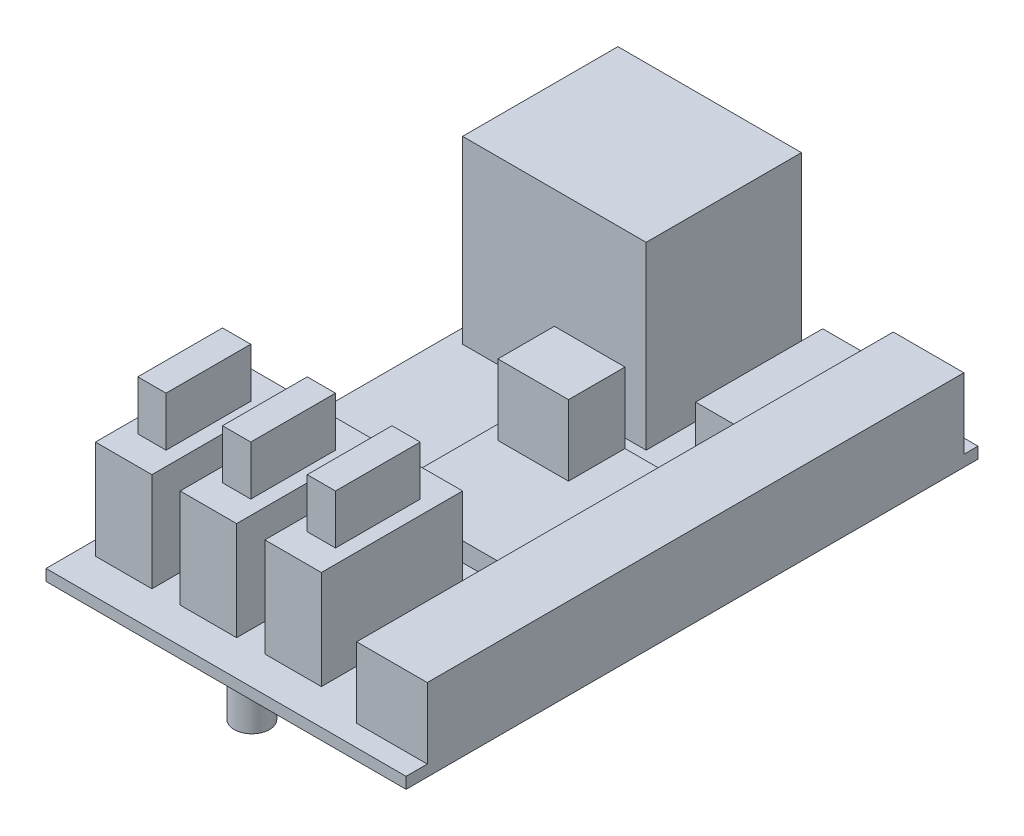
from build123d import *

# Parameters (mm, degrees)
SK_P01_STANDOFF_R                  = 2.5
P01_STANDOFF_DEPTH                 = 6
SK_P02_STANDOFF_R                  = 2.5
P02_STANDOFF_DEPTH                 = 6
P03_PERMAPROTOHALFSIZEBOARD_START  = 6
SK_P03_PERMAPROTOHALFSIZEBOARD_W   = 51
SK_P03_PERMAPROTOHALFSIZEBOARD_H   = 81
P03_PERMAPROTOHALFSIZEBOARD_DEPTH  = 1.6
P04_K1RELAYCB1AFP12V_START         = 7.6
SK_P04_K1RELAYCB1AFP12V_W          = 26
SK_P04_K1RELAYCB1AFP12V_H          = 22
P04_K1RELAYCB1AFP12V_DEPTH         = 25.5
P05_R1D3D4K1COIL_START             = 7.6
SK_P05_R1D3D4K1COIL_W              = 8
SK_P05_R1D3D4K1COIL_H              = 18
P05_R1D3D4K1COIL_DEPTH             = 5.4
P06_INA2601MOTOR_START             = 7.6
SK_P06_INA2601MOTOR_W              = 22.9
SK_P06_INA2601MOTOR_H              = 22.8
P06_INA2601MOTOR_DEPTH             = 2.7
P07_INA260TERMINALBLOCK_START      = 10.3
SK_P07_INA260TERMINALBLOCK_W       = 10
SK_P07_INA260TERMINALBLOCK_H       = 8
P07_INA260TERMINALBLOCK_DEPTH      = 10
P08_F1HOLDER30APCBBLADE_START      = 7.6
SK_P08_F1HOLDER30APCBBLADE_W       = 8
SK_P08_F1HOLDER30APCBBLADE_H       = 20
P08_F1HOLDER30APCBBLADE_DEPTH      = 14
P09_F115AFUSE_START                = 21.6
SK_P09_F115AFUSE_W                 = 4
SK_P09_F115AFUSE_H                 = 12
P09_F115AFUSE_DEPTH                = 7
P10_F3HOLDER_START                 = 7.6
SK_P10_F3HOLDER_W                  = 8
SK_P10_F3HOLDER_H                  = 20
P10_F3HOLDER_DEPTH                 = 14
P11_F33AFUSE_START                 = 21.6
SK_P11_F33AFUSE_W                  = 4
SK_P11_F33AFUSE_H                  = 12
P11_F33AFUSE_DEPTH                 = 7
P12_F4HOLDER_START                 = 7.6
SK_P12_F4HOLDER_W                  = 8
SK_P12_F4HOLDER_H                  = 20
P12_F4HOLDER_DEPTH                 = 14
P13_F43AFUSE_START                 = 21.6
SK_P13_F43AFUSE_W                  = 4
SK_P13_F43AFUSE_H                  = 12
P13_F43AFUSE_DEPTH                 = 7
P14_TERMINALBLOCKSTB1TB4WIRE_START = 7.6
SK_P14_TERMINALBLOCKSTB1TB4WIRE_W  = 10
SK_P14_TERMINALBLOCKSTB1TB4WIRE_H  = 76
P14_TERMINALBLOCKSTB1TB4WIRE_DEPTH = 10


with BuildPart() as part:
    # SK_P01_Standoff → P01_Standoff (new body)
    with BuildSketch(Plane(origin=(0, 0, 0), x_dir=(1, 0, 0), z_dir=(0, 1, 0))):
        with Locations(Location((0, 36.85, 0), (0, 0, 270))):
            Circle(SK_P01_STANDOFF_R)
    extrude(amount=P01_STANDOFF_DEPTH)



with BuildPart() as body_2:
    # SK_P02_Standoff → P02_Standoff (new body)
    with BuildSketch(Plane(origin=(0, 0, 0), x_dir=(1, 0, 0), z_dir=(0, 1, 0))):
        with Locations(Location((0, -36.85, 0), (0, 0, 270))):
            Circle(SK_P02_STANDOFF_R)
    extrude(amount=P02_STANDOFF_DEPTH)


with BuildPart() as part_1:
    add(part.part)

    add(body_2.part)  # P03_PermaProtohalfsizeboard merges body 2
    # SK_P03_PermaProtohalfsizeboard → P03_PermaProtohalfsizeboard (add)
    with BuildSketch(Plane(origin=(0, 0, 0), x_dir=(1, 0, 0), z_dir=(0, 1, 0)).offset(P03_PERMAPROTOHALFSIZEBOARD_START)):
        Rectangle(SK_P03_PERMAPROTOHALFSIZEBOARD_W, SK_P03_PERMAPROTOHALFSIZEBOARD_H)
    extrude(amount=P03_PERMAPROTOHALFSIZEBOARD_DEPTH)

    # SK_P04_K1relayCB1aFP12V → P04_K1relayCB1aFP12V (add)
    with BuildSketch(Plane(origin=(0, 0, 0), x_dir=(1, 0, 0), z_dir=(0, 1, 0)).offset(P04_K1RELAYCB1AFP12V_START)):
        with Locations((-10.5, 27.5)):
            Rectangle(SK_P04_K1RELAYCB1AFP12V_W, SK_P04_K1RELAYCB1AFP12V_H)
    extrude(amount=P04_K1RELAYCB1AFP12V_DEPTH)

    # SK_P05_R1D3D4K1coil → P05_R1D3D4K1coil (add)
    with BuildSketch(Plane(origin=(0, 0, 0), x_dir=(1, 0, 0), z_dir=(0, 1, 0)).offset(P05_R1D3D4K1COIL_START)):
        with Locations((9.5, 29.5)):
            Rectangle(SK_P05_R1D3D4K1COIL_W, SK_P05_R1D3D4K1COIL_H)
    extrude(amount=P05_R1D3D4K1COIL_DEPTH)

    # SK_P06_INA2601motor → P06_INA2601motor (add)
    with BuildSketch(Plane(origin=(0, 0, 0), x_dir=(1, 0, 0), z_dir=(0, 1, 0)).offset(P06_INA2601MOTOR_START)):
        with Locations((2.95, 1.1)):
            Rectangle(SK_P06_INA2601MOTOR_W, SK_P06_INA2601MOTOR_H)
    extrude(amount=P06_INA2601MOTOR_DEPTH)

    # SK_P07_INA260terminalblock → P07_INA260terminalblock (add)
    with BuildSketch(Plane(origin=(0, 0, 0), x_dir=(1, 0, 0), z_dir=(0, 1, 0)).offset(P07_INA260TERMINALBLOCK_START)):
        with Locations((-1.5, 8.5)):
            Rectangle(SK_P07_INA260TERMINALBLOCK_W, SK_P07_INA260TERMINALBLOCK_H)
    extrude(amount=P07_INA260TERMINALBLOCK_DEPTH)

    # SK_P08_F1holder30APCBblade → P08_F1holder30APCBblade (add)
    with BuildSketch(Plane(origin=(0, 0, 0), x_dir=(1, 0, 0), z_dir=(0, 1, 0)).offset(P08_F1HOLDER30APCBBLADE_START)):
        with Locations((-19.5, -25.5)):
            Rectangle(SK_P08_F1HOLDER30APCBBLADE_W, SK_P08_F1HOLDER30APCBBLADE_H)
    extrude(amount=P08_F1HOLDER30APCBBLADE_DEPTH)

    # SK_P09_F115Afuse → P09_F115Afuse (add)
    with BuildSketch(Plane(origin=(0, 0, 0), x_dir=(1, 0, 0), z_dir=(0, 1, 0)).offset(P09_F115AFUSE_START)):
        with Locations((-19.5, -25.5)):
            Rectangle(SK_P09_F115AFUSE_W, SK_P09_F115AFUSE_H)
    extrude(amount=P09_F115AFUSE_DEPTH)

    # SK_P10_F3holder → P10_F3holder (add)
    with BuildSketch(Plane(origin=(0, 0, 0), x_dir=(1, 0, 0), z_dir=(0, 1, 0)).offset(P10_F3HOLDER_START)):
        with Locations((-7.5, -25.5)):
            Rectangle(SK_P10_F3HOLDER_W, SK_P10_F3HOLDER_H)
    extrude(amount=P10_F3HOLDER_DEPTH)

    # SK_P11_F33Afuse → P11_F33Afuse (add)
    with BuildSketch(Plane(origin=(0, 0, 0), x_dir=(1, 0, 0), z_dir=(0, 1, 0)).offset(P11_F33AFUSE_START)):
        with Locations((-7.5, -25.5)):
            Rectangle(SK_P11_F33AFUSE_W, SK_P11_F33AFUSE_H)
    extrude(amount=P11_F33AFUSE_DEPTH)

    # SK_P12_F4holder → P12_F4holder (add)
    with BuildSketch(Plane(origin=(0, 0, 0), x_dir=(1, 0, 0), z_dir=(0, 1, 0)).offset(P12_F4HOLDER_START)):
        with Locations((4.5, -25.5)):
            Rectangle(SK_P12_F4HOLDER_W, SK_P12_F4HOLDER_H)
    extrude(amount=P12_F4HOLDER_DEPTH)

    # SK_P13_F43Afuse → P13_F43Afuse (add)
    with BuildSketch(Plane(origin=(0, 0, 0), x_dir=(1, 0, 0), z_dir=(0, 1, 0)).offset(P13_F43AFUSE_START)):
        with Locations((4.5, -25.5)):
            Rectangle(SK_P13_F43AFUSE_W, SK_P13_F43AFUSE_H)
    extrude(amount=P13_F43AFUSE_DEPTH)

    # SK_P14_TerminalblocksTB1TB4wire → P14_TerminalblocksTB1TB4wire (add)
    with BuildSketch(Plane(origin=(0, 0, 0), x_dir=(1, 0, 0), z_dir=(0, 1, 0)).offset(P14_TERMINALBLOCKSTB1TB4WIRE_START)):
        with Locations((20.5, 0.5)):
            Rectangle(SK_P14_TERMINALBLOCKSTB1TB4WIRE_W, SK_P14_TERMINALBLOCKSTB1TB4WIRE_H)
    extrude(amount=P14_TERMINALBLOCKSTB1TB4WIRE_DEPTH)


solid = part_1.part
